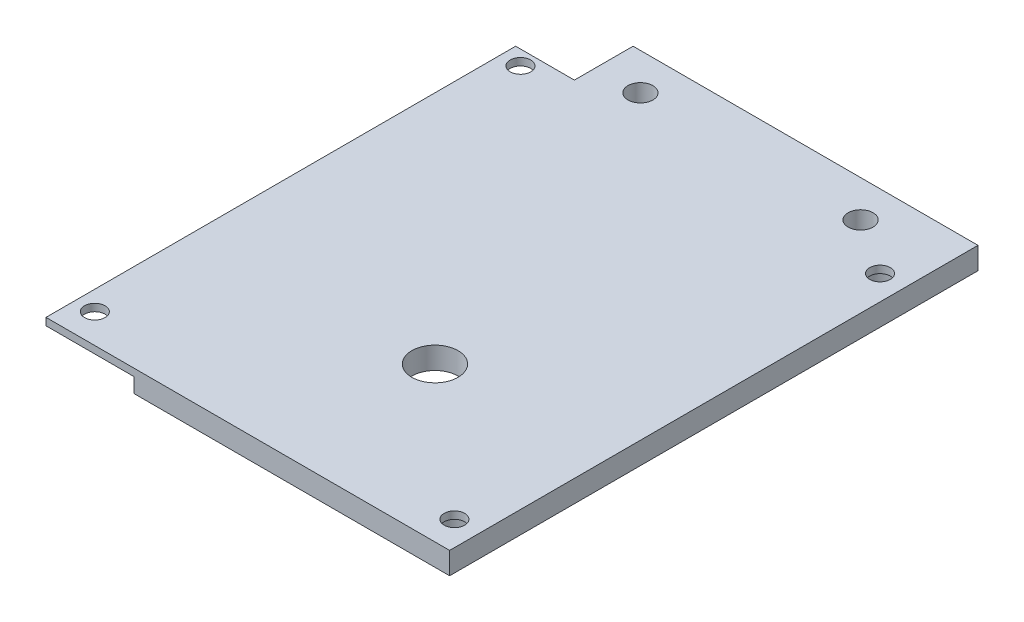
from build123d import *

# Parameters (mm, degrees)
ESQUISSE1_R             = 1.7
ESQUISSE1_R_2           = 3.15
ESQUISSE1_R_3           = 1.4
BOSS_EXTRU_3_DEPTH      = 3
ESQUISSE1_5_R           = 1.4
ESQUISSE1_5_R_2         = 2.4
ENL_V_MAT_EXTRU_7_DEPTH = 2


with BuildPart() as part:
    # Esquisse1 → Boss.-Extru.3 (new body)
    with BuildSketch(Plane(origin=(0, 0, 0), x_dir=(1, 0, 0), z_dir=(0, 1, 0))):
        Polygon((-21, 36), (-21, 28), (-29, 28), (-29, -36), (26, -36), (26, 36), align=None)
        with Locations((15, 31)):
            Circle(ESQUISSE1_R, mode=Mode.SUBTRACT)
        with Locations((3, -15)):
            Circle(ESQUISSE1_R_2, mode=Mode.SUBTRACT)
        with Locations((-15, 31)):
            Circle(ESQUISSE1_R, mode=Mode.SUBTRACT)
        with Locations((-26.347888471, 26)):
            Circle(ESQUISSE1_R_3, mode=Mode.SUBTRACT)
        with Locations((-26.347888471, -32)):
            Circle(ESQUISSE1_R_3, mode=Mode.SUBTRACT)
        with Locations((22.652111529, -32)):
            Circle(ESQUISSE1_R_3, mode=Mode.SUBTRACT)
        with Locations((22.652111529, 26)):
            Circle(ESQUISSE1_R_3, mode=Mode.SUBTRACT)
    extrude(amount=BOSS_EXTRU_3_DEPTH)

    # Esquisse1<5> → Enlèv. mat.-Extru.7 (cut)
    # profile 1 of 3: a face of its own
    with BuildSketch(Plane(origin=(0, 0, 0), x_dir=(1, 0, 0), z_dir=(0, 1, 0))):
        Polygon((-17, 36), (-21, 36), (-21, 28), (-29, 28), (-29, -36), (-17, -36), align=None)
        with Locations((-26.347888471, 26)):
            Circle(ESQUISSE1_5_R, mode=Mode.SUBTRACT)
        with Locations((-26.347888471, -32)):
            Circle(ESQUISSE1_5_R, mode=Mode.SUBTRACT)
    # profile 2 of 3: a face of its own
    with BuildSketch(Plane(origin=(0, 0, 0), x_dir=(1, 0, 0), z_dir=(0, 1, 0))):
        with Locations((22.652111529, 26)):
            Circle(ESQUISSE1_5_R_2)
        with Locations((22.652111529, 26)):
            Circle(ESQUISSE1_5_R, mode=Mode.SUBTRACT)
    # profile 3 of 3: a face of its own
    with BuildSketch(Plane(origin=(0, 0, 0), x_dir=(1, 0, 0), z_dir=(0, 1, 0))):
        with Locations((22.652111529, -32)):
            Circle(ESQUISSE1_5_R_2)
        with Locations((22.652111529, -32)):
            Circle(ESQUISSE1_5_R, mode=Mode.SUBTRACT)
    extrude(amount=ENL_V_MAT_EXTRU_7_DEPTH, mode=Mode.SUBTRACT)


solid = part.part
